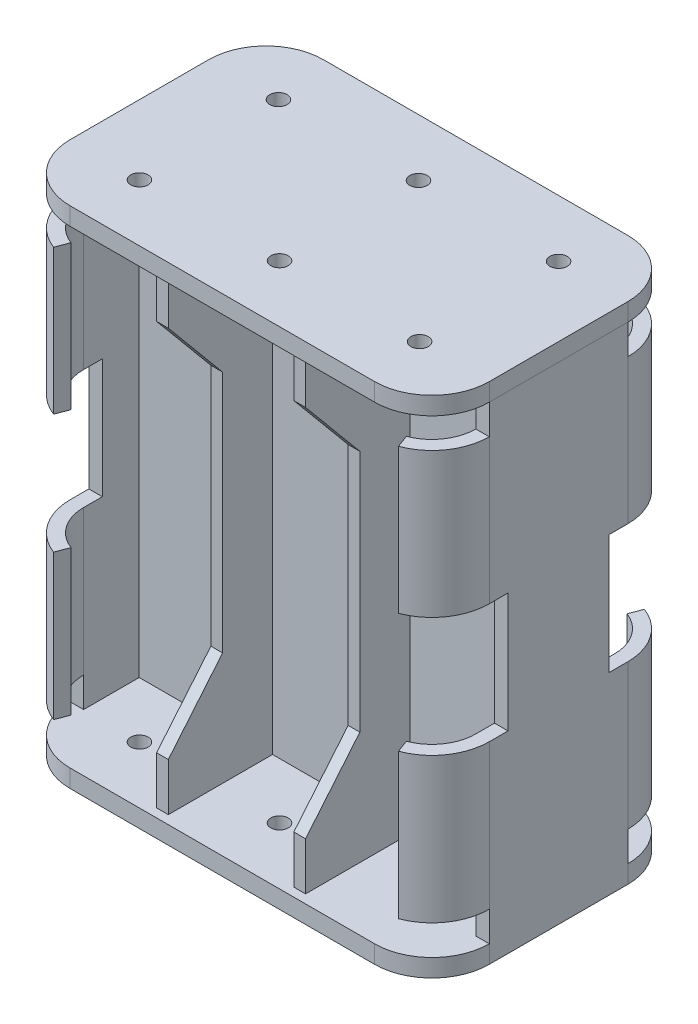
from build123d import *

# Parameters (mm, degrees)
BOSS_EXTRUDE1_DEPTH     = 2.05
BOSS_EXTRUDE2_DEPTH     = 54
BOSS_EXTRUDE9_START     = 56.05
BOSS_EXTRUDE9_DEPTH     = 2.05
SKETCH3_W               = 23.613559859
SKETCH3_H               = 13.75
CUT_EXTRUDE2_DEPTH      = 12.5
CUT_EXTRUDE4_START      = -40
SKETCH3_2_W             = 23.613559859
SKETCH3_2_H             = 13.75
CUT_EXTRUDE4_DEPTH      = 12.5
CUT_EXTRUDE5_DEPTH      = 22.5
CUT_EXTRUDE5_DEPTH_BACK = 5
SKETCH8_R               = 1
CUT_EXTRUDE6_DEPTH      = 85


with BuildPart() as part:
    # Sketch1 → Boss-Extrude1 (new body)
    with BuildSketch(Plane(origin=(0, 0, 0), x_dir=(1, 0, 0), z_dir=(0, 1, 0))):
        with BuildLine():
            Line((6.6, 0), (41.65, 0))
            ThreePointArc((41.65, 0), (46.316904756, -1.933095244), (48.25, -6.6))
            Line((48.25, -6.6), (48.25, -22.55))
            ThreePointArc((48.25, -22.55), (46.316904756, -27.216904756), (41.65, -29.15))
            Line((41.65, -29.15), (6.6, -29.15))
            ThreePointArc((6.6, -29.15), (1.933095244, -27.216904756), (0, -22.55))
            Line((0, -22.55), (0, -6.6))
            ThreePointArc((0, -6.6), (1.933095244, -1.933095244), (6.6, 0))
        make_face()
    extrude(amount=BOSS_EXTRUDE1_DEPTH)

    # Sketch2 → Boss-Extrude2 (add)
    with BuildSketch(Plane(origin=(0, 2.05, 0), x_dir=(1, 0, 0), z_dir=(0, 1, 0))):
        with BuildLine():
            Line((16.9, -13), (31.35, -13))
            Line((31.35, -13), (31.35, 0))
            Line((31.35, 0), (32.7, 0))
            Line((32.7, 0), (32.7, -13))
            Line((32.7, -13), (46.7, -13))
            Line((46.7, -13), (46.7, -6.6))
            ThreePointArc((46.7, -6.6), (45.802684456, -3.726376536), (43.429619084, -1.873959806))
            Line((43.429619084, -1.873959806), (43.975838803, -0.423393014))
            ThreePointArc((43.975838803, -0.423393014), (47.077270774, -2.844373295), (48.25, -6.6))
            Line((48.25, -6.6), (48.25, -13))
            Line((48.25, -13), (48.25, -16.15))
            Line((48.25, -16.15), (48.25, -22.55))
            ThreePointArc((48.25, -22.55), (47.077270774, -26.305626705), (43.975838803, -28.726606986))
            Line((43.975838803, -28.726606986), (43.429619084, -27.276040194))
            ThreePointArc((43.429619084, -27.276040194), (45.802684456, -25.423623464), (46.7, -22.55))
            Line((46.7, -22.55), (46.7, -16.15))
            Line((46.7, -16.15), (32.7, -16.15))
            Line((32.7, -16.15), (32.7, -29.15))
            Line((32.7, -29.15), (31.35, -29.15))
            Line((31.35, -29.15), (31.35, -16.15))
            Line((31.35, -16.15), (16.9, -16.15))
            Line((16.9, -16.15), (16.9, -29.15))
            Line((16.9, -29.15), (15.55, -29.15))
            Line((15.55, -29.15), (15.55, -16.15))
            Line((15.55, -16.15), (1.55, -16.15))
            Line((1.55, -16.15), (1.55, -22.55))
            ThreePointArc((1.55, -22.55), (2.447315544, -25.423623464), (4.820380916, -27.276040194))
            Line((4.820380916, -27.276040194), (4.274161197, -28.726606986))
            ThreePointArc((4.274161197, -28.726606986), (1.172729226, -26.305626705), (0, -22.55))
            Line((0, -22.55), (0, -16.15))
            Line((0, -16.15), (0, -13))
            Line((0, -13), (0, -6.6))
            ThreePointArc((0, -6.6), (1.172729226, -2.844373295), (4.274161197, -0.423393014))
            Line((4.274161197, -0.423393014), (4.820380916, -1.873959806))
            ThreePointArc((4.820380916, -1.873959806), (2.447315544, -3.726376536), (1.55, -6.6))
            Line((1.55, -6.6), (1.55, -13))
            Line((1.55, -13), (15.55, -13))
            Line((15.55, -13), (15.55, 0))
            Line((15.55, 0), (16.9, 0))
            Line((16.9, 0), (16.9, -13))
        make_face()
    extrude(amount=BOSS_EXTRUDE2_DEPTH)

    # Sketch3 → Cut-Extrude2 (cut)
    with BuildSketch(Plane(origin=(48.25, 0, 0), x_dir=(0, 0, -1), z_dir=(1, 0, 0))):
        Polygon((-6.6, 56.05), (-6.6, 52.6), (7.429897114, 52.6), (10.879897114, 56.05), align=None)
        with Locations((3.05677993, 29.075)):
            Rectangle(SKETCH3_W, SKETCH3_H)
        Polygon((10.879897114, 2.05), (-6.6, 2.05), (-6.6, 5.5), (7.429897114, 5.5), align=None)
        Polygon((-22.55, 2.05), (-22.55, 5.5), (-36.579897114, 5.5), (-40.029897114, 2.05), align=None)
        Polygon((-40.029897114, 56.05), (-22.55, 56.05), (-22.55, 52.6), (-36.579897114, 52.6), align=None)
        Polygon((-20.4, 22.2), (-42.823196098, 22.2), (-44.013559859, 35.95), (-20.4, 35.95), align=None)
    extrude(amount=-CUT_EXTRUDE2_DEPTH, mode=Mode.SUBTRACT)

    # Sketch3<2> → Cut-Extrude4 (cut)
    with BuildSketch(Plane(origin=(48.25, 0, 0), x_dir=(0, 0, -1), z_dir=(1, 0, 0)).offset(CUT_EXTRUDE4_START)):
        Polygon((-6.6, 56.05), (-6.6, 52.6), (7.429897114, 52.6), (10.879897114, 56.05), align=None)
        with Locations((3.05677993, 29.075)):
            Rectangle(SKETCH3_2_W, SKETCH3_2_H)
        Polygon((10.879897114, 2.05), (-6.6, 2.05), (-6.6, 5.5), (7.429897114, 5.5), align=None)
        Polygon((-22.55, 2.05), (-22.55, 5.5), (-36.579897114, 5.5), (-40.029897114, 2.05), align=None)
        Polygon((-40.029897114, 56.05), (-22.55, 56.05), (-22.55, 52.6), (-36.579897114, 52.6), align=None)
        Polygon((-20.4, 22.2), (-42.823196098, 22.2), (-44.013559859, 35.95), (-20.4, 35.95), align=None)
    extrude(amount=-CUT_EXTRUDE4_DEPTH, mode=Mode.SUBTRACT)

    # Sketch4 → Cut-Extrude5 (cut, two sides: drawn at the far end of the back side and taken through both)
    with BuildSketch(Plane(origin=(16.9, 0, 0), x_dir=(0, 0, -1), z_dir=(1, 0, 0)).offset(-CUT_EXTRUDE5_DEPTH_BACK)):
        Polygon((-29.15, 2.05), (-28.15, 2.05), (-28.15, 7.55), (-21.9, 15.05), (-21.9, 43.05), (-28.15, 50.55), (-28.15, 56.05), (-29.15, 56.05), align=None)
        Polygon((0, 56.05), (-1, 56.05), (-1, 50.55), (-7.25, 43.05), (-7.25, 15.05), (-1, 7.55), (-1, 2.05), (0, 2.05), align=None)
    extrude(amount=CUT_EXTRUDE5_DEPTH + CUT_EXTRUDE5_DEPTH_BACK, mode=Mode.SUBTRACT)


with BuildPart() as body_2:
    # Sketch1<6> → Boss-Extrude9 (new body)
    with BuildSketch(Plane(origin=(0, 0, 0), x_dir=(1, 0, 0), z_dir=(0, 1, 0)).offset(BOSS_EXTRUDE9_START)):
        with BuildLine():
            Line((6.6, 0), (41.65, 0))
            ThreePointArc((41.65, 0), (46.316904756, -1.933095244), (48.25, -6.6))
            Line((48.25, -6.6), (48.25, -22.55))
            ThreePointArc((48.25, -22.55), (46.316904756, -27.216904756), (41.65, -29.15))
            Line((41.65, -29.15), (6.6, -29.15))
            ThreePointArc((6.6, -29.15), (1.933095244, -27.216904756), (0, -22.55))
            Line((0, -22.55), (0, -6.6))
            ThreePointArc((0, -6.6), (1.933095244, -1.933095244), (6.6, 0))
        make_face()
    extrude(amount=BOSS_EXTRUDE9_DEPTH)


with BuildPart() as cut_extrude6_tool:
    # Sketch8 → Cut-Extrude6 (new body)
    with BuildSketch(Plane(origin=(0, 58.1, 0), x_dir=(1, 0, 0), z_dir=(0, 1, 0))):
        with Locations((8, -6.575)):
            Circle(SKETCH8_R)
        with Locations((24.125, -6.575)):
            Circle(SKETCH8_R)
        with Locations((40.25, -6.575)):
            Circle(SKETCH8_R)
        with Locations((40.25, -22.575)):
            Circle(SKETCH8_R)
        with Locations((24.125, -22.575)):
            Circle(SKETCH8_R)
        with Locations((8, -22.575)):
            Circle(SKETCH8_R)
    extrude(amount=-CUT_EXTRUDE6_DEPTH)


with BuildPart() as part_1:
    add(part.part)

    # Cut-Extrude6: cut by cut_extrude6_tool
    add(cut_extrude6_tool.part, mode=Mode.SUBTRACT)


with BuildPart() as body_2_1:
    add(body_2.part)

    # Cut-Extrude6: cut by cut_extrude6_tool
    add(cut_extrude6_tool.part, mode=Mode.SUBTRACT)


solid = Compound([part_1.part, body_2_1.part])
